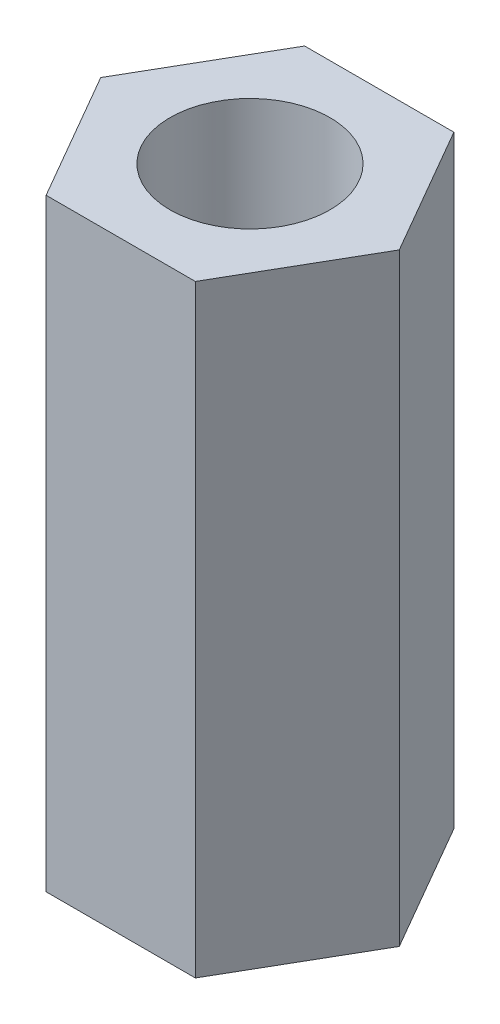
from build123d import *

# Parameters (mm, degrees)
BOSS_EXTRUDE1_DEPTH              = 11.1125
F_97_0_0059_DIAMETER_HOLE1_D     = 2.9464
F_97_0_0059_DIAMETER_HOLE1_DEPTH = 25.4
F_97_0_0059_DIAMETER_HOLE1_TIP   = 0.885187864


with BuildPart() as part:
    # Sketch1 → Boss-Extrude1 (new body)
    with BuildSketch(Plane(origin=(0, 0, 0), x_dir=(1, 0, 0), z_dir=(0, 1, 0))):
        Polygon((2.749630657, 0), (1.374815329, 2.38125), (-1.374815329, 2.38125), (-2.749630657, 0), (-1.374815329, -2.38125), (1.374815329, -2.38125), align=None)
    extrude(amount=BOSS_EXTRUDE1_DEPTH)

    # #97 (0.0059) Diameter Hole1
    with Locations(Plane(origin=(0, 11.1125, 0), x_dir=(1, 0, 0), z_dir=(0, 1, 0))):
        with Locations((0, 0)):
            Hole(F_97_0_0059_DIAMETER_HOLE1_D / 2, depth=F_97_0_0059_DIAMETER_HOLE1_DEPTH)
            with Locations((0, 0, -(F_97_0_0059_DIAMETER_HOLE1_DEPTH + F_97_0_0059_DIAMETER_HOLE1_TIP / 2))):  # 118° drill point
                Cone(0, F_97_0_0059_DIAMETER_HOLE1_D / 2, F_97_0_0059_DIAMETER_HOLE1_TIP, mode=Mode.SUBTRACT)


solid = part.part
